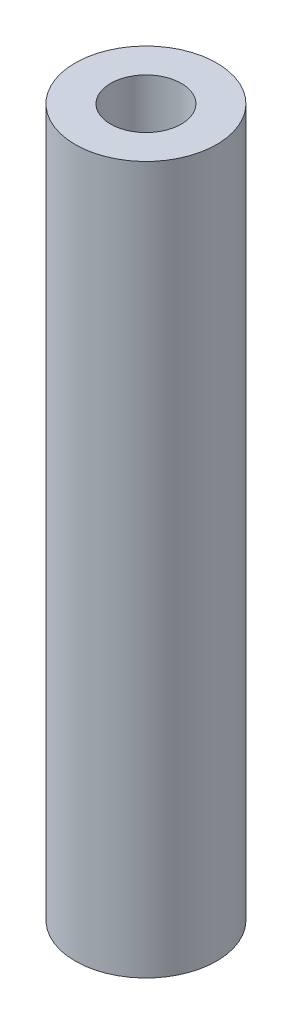
from build123d import *

# Parameters (mm, degrees)
SKETCH2_R           = 5
BOSS_EXTRUDE1_DEPTH = 50
SKETCH3_R           = 2.5
CUT_EXTRUDE1_DEPTH  = 30


with BuildPart() as part:
    # Sketch2 → Boss-Extrude1 (new body)
    with BuildSketch(Plane(origin=(0, 0, 0), x_dir=(1, 0, 0), z_dir=(0, 1, 0))):
        with Locations(Location((0, 0, 0), (0, 0, 270))):
            Circle(SKETCH2_R)
    extrude(amount=BOSS_EXTRUDE1_DEPTH)

    # Sketch3 → Cut-Extrude1 (cut)
    with BuildSketch(Plane(origin=(0, 50, 0), x_dir=(1, 0, 0), z_dir=(0, 1, 0))):
        with Locations(Location((0, 0, 0), (0, 0, 270))):
            Circle(SKETCH3_R)
    extrude(amount=-CUT_EXTRUDE1_DEPTH, mode=Mode.SUBTRACT)


solid = part.part
